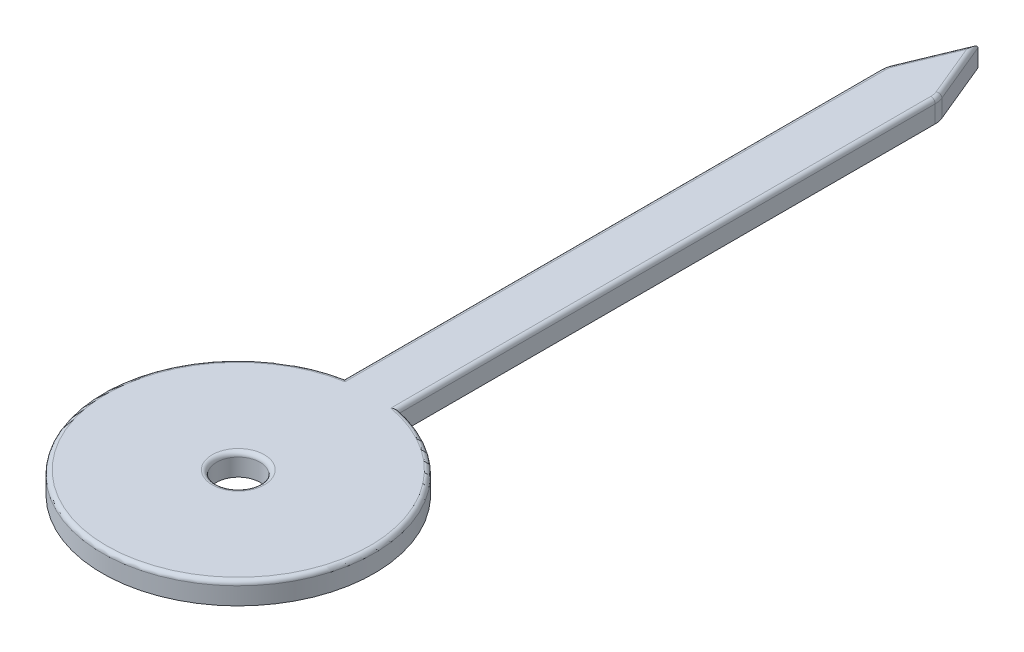
from build123d import *

# Parameters (mm, degrees)
SKETCH_1_R      = 0.1
EXTRUDE_1_DEPTH = 0.1
FILLET_1_R      = 0.1
FILLET_2_R      = 0.02


with BuildPart() as part:
    # 草图1 → 凸台-拉伸1 (new body)
    with BuildSketch(Plane(origin=(0, 0, 0), x_dir=(1, 0, 0), z_dir=(0, 1, 0))):
        with BuildLine():
            Line((-0.125, 3.098223305), (0, 3.4))
            Line((0, 3.4), (0.125, 3.098223305))
            Line((0.125, 3.098223305), (0.125, 0.612372436))
            ThreePointArc((0.125, 0.612372436), (0, -0.625), (-0.125, 0.612372436))
            Line((-0.125, 0.612372436), (-0.125, 3.098223305))
        make_face()
        with Locations(Location((0, 0, 0), (0, 0, 270))):
            Circle(SKETCH_1_R, mode=Mode.SUBTRACT)
    extrude(amount=EXTRUDE_1_DEPTH)

    # 圆角1
    fillet_1_edges = [part.edges().sort_by_distance(p)[0] for p in [
        (0.125, 0.05, -3.098223305),
        (-0.125, 0.05, -3.098223305),
    ]]
    fillet(fillet_1_edges, radius=FILLET_1_R)

    # 圆角2
    fillet_2_edges = [part.edges().sort_by_distance(p)[0] for p in [
        (-0.125, 0.1, -1.845352252),
        (-0.123078528, 0.1, -3.0978411),
        (0, 0.1, 0.625),
        (-0.058693977, 0.1, -3.258300206),
        (0.125, 0.1, -1.845352252),
        (0.058693977, 0.1, -3.258300206),
        (0.123078528, 0.1, -3.0978411),
        (0, 0.1, -0.1),
    ]]
    fillet(fillet_2_edges, radius=FILLET_2_R)


solid = part.part
